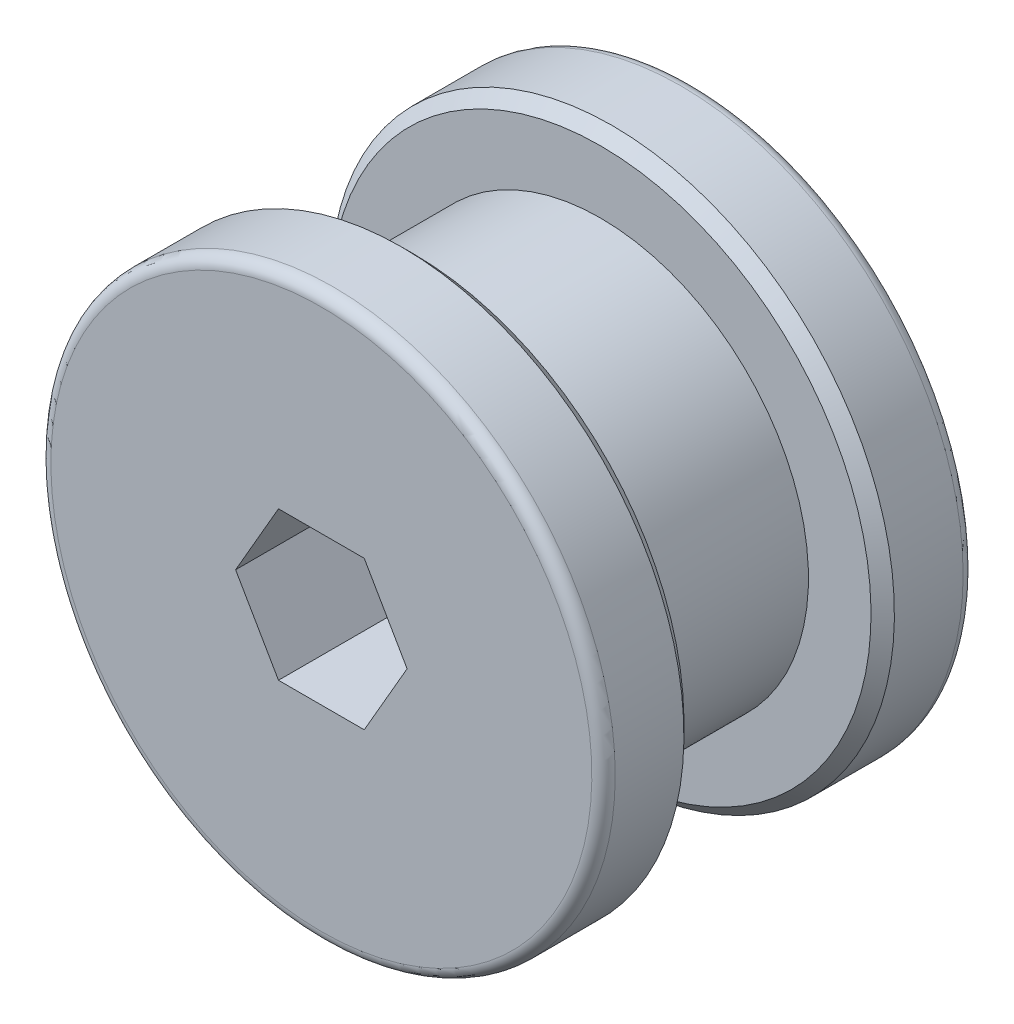
from build123d import *

# Parameters (mm, degrees)
FILLET1_R               = 1
CHAMFER1_SIZE           = 1
CUT_EXTRUDE1_DEPTH      = 47.610903231
CUT_EXTRUDE1_DEPTH_BACK = 47.610903231


with BuildPart() as part:
    # Sketch1 → Revolve3 (revolve)
    with BuildSketch(Plane(origin=(0, 0, 0), x_dir=(0, 0, -1), z_dir=(1, 0, 0))):
        Polygon((0, 0), (0, 17.78), (-8, 17.78), (-8, 24.13), (-15.875, 24.13), (-15.875, 0), align=None)
        Polygon((8, 17.78), (0, 17.78), (0, 0), (15.875, 0), (15.875, 24.13), (8, 24.13), align=None)
    revolve(axis=Axis((0, 0, -15.875), (0, 0, 1)))

    # Fillet1
    fillet1_edges = [part.edges().sort_by_distance(p)[0] for p in [
        (0, -24.13, -15.875),
        (0, -24.13, 15.875),
    ]]
    fillet(fillet1_edges, radius=FILLET1_R)

    # Chamfer1
    chamfer1_edges = [part.edges().sort_by_distance(p)[0] for p in [
        (0, -24.13, -8),
        (0, -24.13, 8),
    ]]
    chamfer(chamfer1_edges, length=CHAMFER1_SIZE)

    # Sketch2 → Cut-Extrude1 (cut, two sides: drawn at the far end of the back side and taken through both)
    with BuildSketch(Plane.XY.offset(15.875).offset(-CUT_EXTRUDE1_DEPTH_BACK)):
        Polygon((7.332348419, 0), (3.666174209, 6.35), (-3.666174209, 6.35), (-7.332348419, 0), (-3.666174209, -6.35), (3.666174209, -6.35), align=None)
    extrude(amount=CUT_EXTRUDE1_DEPTH + CUT_EXTRUDE1_DEPTH_BACK, mode=Mode.SUBTRACT)


solid = part.part
